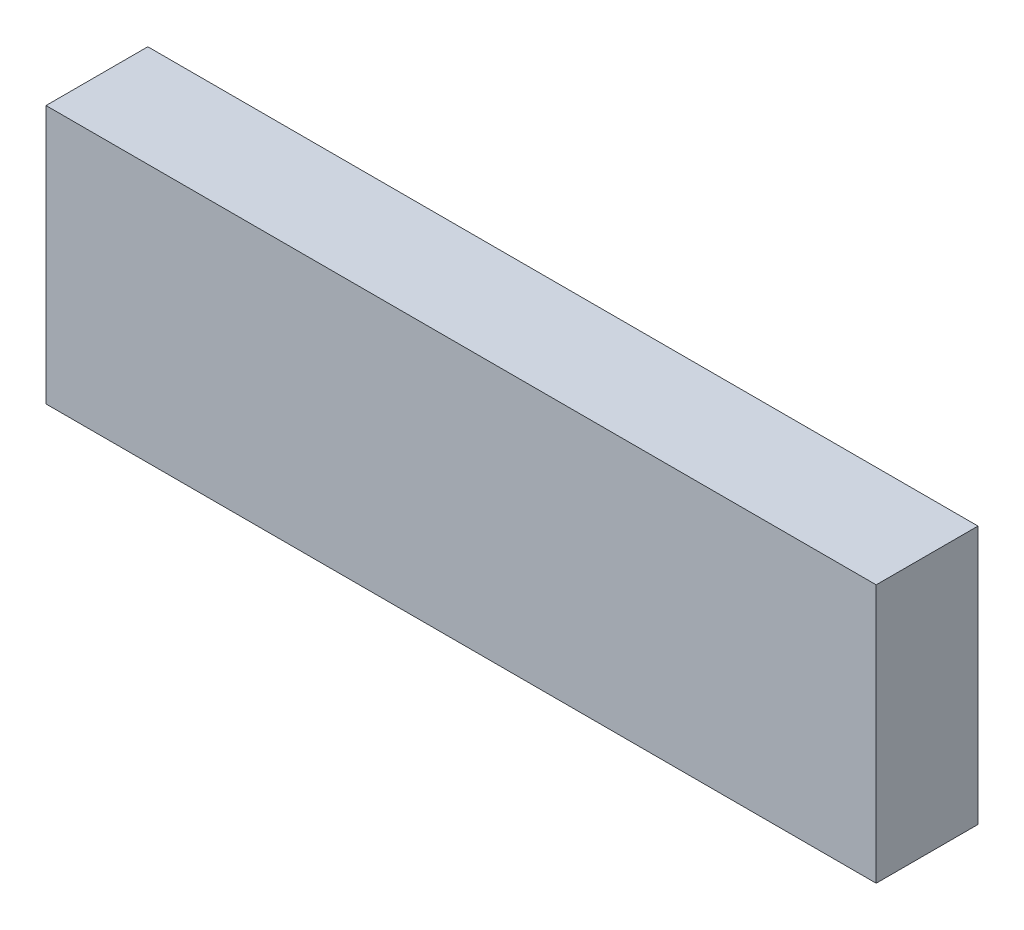
from build123d import *

# Parameters (mm, degrees)
SKETCH1_W           = 106
SKETCH1_H           = 13
BOSS_EXTRUDE1_DEPTH = 33


with BuildPart() as part:
    # Sketch1 → Boss-Extrude1 (new body)
    with BuildSketch(Plane(origin=(0, 0, 0), x_dir=(1, 0, 0), z_dir=(0, 1, 0))):
        with Locations((53, 6.5)):
            Rectangle(SKETCH1_W, SKETCH1_H)
    extrude(amount=BOSS_EXTRUDE1_DEPTH)


solid = part.part
